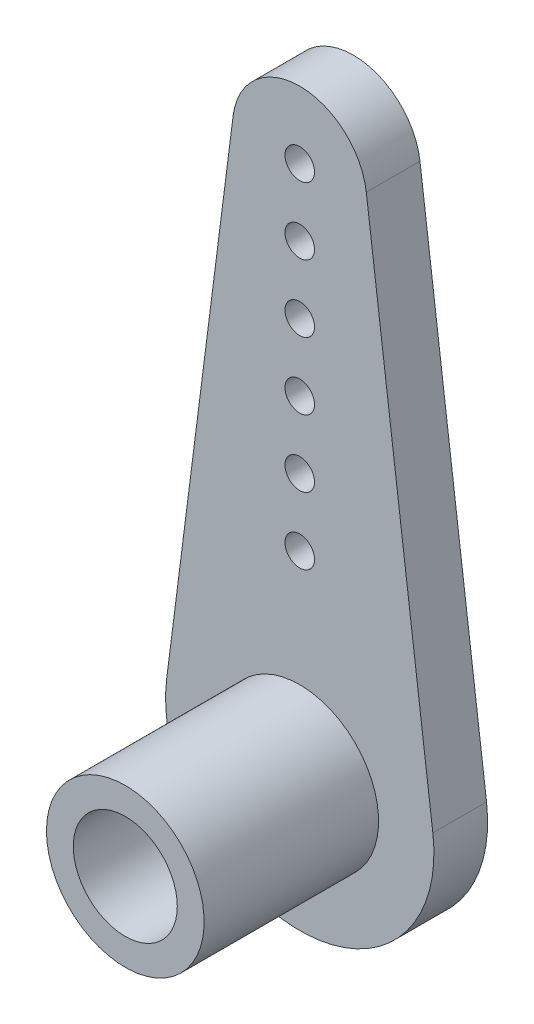
from build123d import *

# Parameters (mm, degrees)
SKETCH1_R               = 1.1
BOSS_EXTRUDE1_DEPTH     = 4
SKETCH2_R               = 5.875
BOSS_EXTRUDE2_DEPTH     = 13
CUT_EXTRUDE1_DEPTH      = 49.674942219
CUT_EXTRUDE1_DEPTH_BACK = 49.674942219
SKETCH3_R               = 3.875


with BuildPart() as part:
    # Sketch1 → Boss-Extrude1 (new body)
    with BuildSketch(Plane.XY):
        with BuildLine():
            Line((-4.959780557, 40.132911392), (-9.919561113, 1.265822785))
            ThreePointArc((-9.919561113, 1.265822785), (0, -10), (9.919561113, 1.265822785))
            Line((9.919561113, 1.265822785), (4.959780557, 40.132911392))
            ThreePointArc((4.959780557, 40.132911392), (0, 44.5), (-4.959780557, 40.132911392))
        make_face()
        with Locations((0, 39.5)):
            Circle(SKETCH1_R, mode=Mode.SUBTRACT)
        with Locations((0, 34.5)):
            Circle(SKETCH1_R, mode=Mode.SUBTRACT)
        with Locations((0, 29.5)):
            Circle(SKETCH1_R, mode=Mode.SUBTRACT)
        with Locations((0, 24.5)):
            Circle(SKETCH1_R, mode=Mode.SUBTRACT)
        with Locations((0, 19.5)):
            Circle(SKETCH1_R, mode=Mode.SUBTRACT)
        with Locations((0, 14.5)):
            Circle(SKETCH1_R, mode=Mode.SUBTRACT)
    extrude(amount=BOSS_EXTRUDE1_DEPTH)

    # Sketch2 → Boss-Extrude2 (add)
    with BuildSketch(Plane.XY.offset(4)):
        with Locations(Location((0, 0, 0), (0, 0, 180))):
            Circle(SKETCH2_R)
    extrude(amount=BOSS_EXTRUDE2_DEPTH)

    # Sketch3 → Cut-Extrude1 (cut, two sides: drawn at the far end of the back side and taken through both)
    with BuildSketch(Plane.XY.offset(-CUT_EXTRUDE1_DEPTH_BACK)):
        Circle(SKETCH3_R)
    extrude(amount=CUT_EXTRUDE1_DEPTH + CUT_EXTRUDE1_DEPTH_BACK, mode=Mode.SUBTRACT)


solid = part.part
